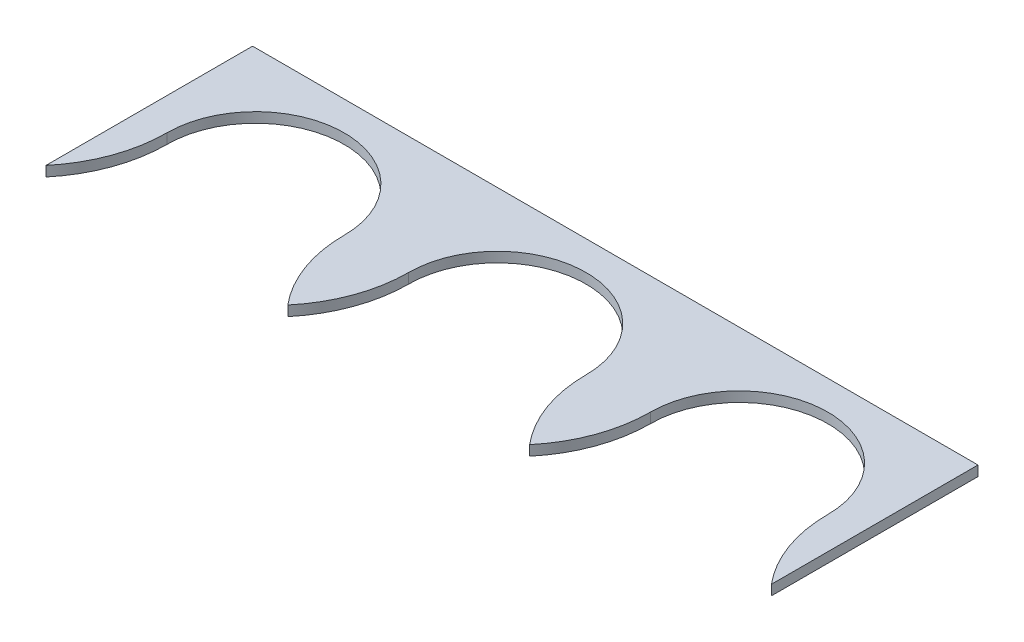
from build123d import *

# Parameters (mm, degrees)
BOSS_EXTRUDE1_DEPTH = 6.35


with BuildPart() as part:
    # Sketch1 → Boss-Extrude1 (new body)
    with BuildSketch(Plane(origin=(0, 0, 0), x_dir=(1, 0, 0), z_dir=(0, 1, 0))):
        with BuildLine():
            ThreePointArc((132.08, -74.295), (137.317671124, -104.024937773), (152.4, -130.175))
            Line((152.4, -130.175), (152.4, 0))
            Line((152.4, 0), (0, 0))
            Line((0, 0), (0, -130.175))
            ThreePointArc((0, -130.175), (15.082328876, -104.024937773), (20.32, -74.295))
            ThreePointArc((20.32, -74.295), (76.2, -18.415), (132.08, -74.295))
        make_face()
        with BuildLine():
            Line((152.4, 0), (152.4, -130.175))
            ThreePointArc((152.4, -130.175), (167.482328876, -104.024937773), (172.72, -74.295))
            ThreePointArc((172.72, -74.295), (228.6, -18.415), (284.48, -74.295))
            ThreePointArc((284.48, -74.295), (289.717671124, -104.024937773), (304.8, -130.175))
            Line((304.8, -130.175), (304.8, 0))
            Line((304.8, 0), (152.4, 0))
        make_face()
        with BuildLine():
            Line((457.2, 0), (304.8, 0))
            Line((304.8, 0), (304.8, -130.175))
            ThreePointArc((304.8, -130.175), (319.882328876, -104.024937773), (325.12, -74.295))
            ThreePointArc((325.12, -74.295), (381, -18.415), (436.88, -74.295))
            ThreePointArc((436.88, -74.295), (442.117671124, -104.024937773), (457.2, -130.175))
            Line((457.2, -130.175), (457.2, 0))
        make_face()
    extrude(amount=-BOSS_EXTRUDE1_DEPTH)


solid = part.part
